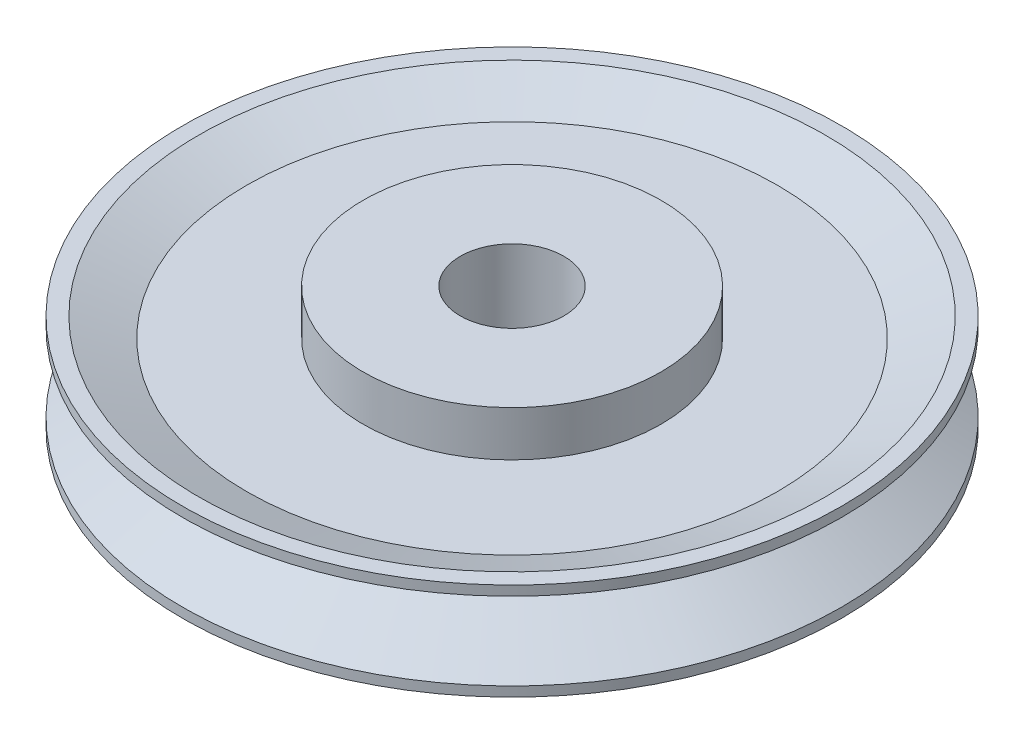
from build123d import *


with BuildPart() as part:
    # Sketch1 → Revolution1 (revolve)
    with BuildSketch(Plane.XY):
        Polygon((3.81, -1.828307296), (3.81, 0.457692704), (3.81, 2.235692704), (0, 2.235692704), (0, -3.606307296), (3.81, -3.606307296), align=None)
        Polygon((8.382, 0.457692704), (3.81, 0.457692704), (3.81, -1.828307296), (8.382, -1.828307296), (10.265714416, -2.590307296), (10.900714416, -2.590307296), (10.900714416, -2.209307296), (8.520461423, -0.685307296), (10.900714416, 0.838692704), (10.900714416, 1.219692704), (10.265714416, 1.219692704), align=None)
    revolve(axis=Axis((-2.032, -2.54, 0), (0, 1, 0)))


solid = part.part
